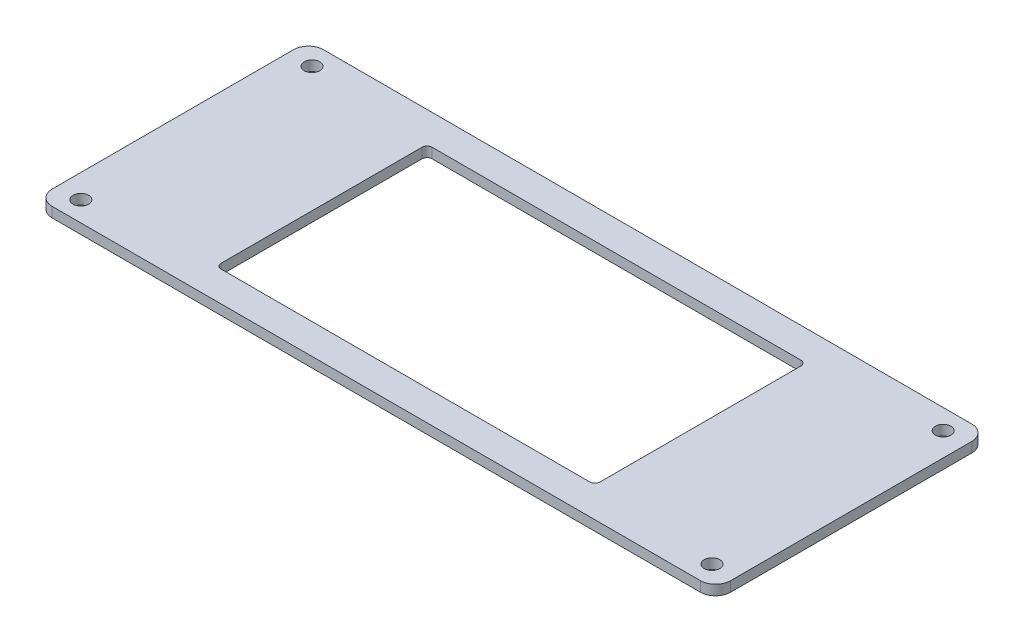
from build123d import *

# Parameters (mm, degrees)
EXTRUDE_1_DEPTH     = 2
SKETCH_3_W          = 10
SKETCH_3_H          = 54
EXTRUDE_2_DEPTH     = 2
SKETCH_2_R          = 1.55
CUT_EXTRUDE_1_DEPTH = 2
FILLET_1_R          = 3


with BuildPart() as part:
    # 草图1 → 凸台-拉伸1 (new body)
    with BuildSketch(Plane(origin=(0, 0, 0), x_dir=(1, 0, 0), z_dir=(0, 1, 0))):
        with BuildLine():
            Line((-59.5, -27), (-62.5, -27))
            Line((-62.5, -27), (-62.5, -24))
            Line((-62.5, -24), (-62.5, 24))
            Line((-62.5, 24), (-62.5, 27))
            Line((-62.5, 27), (-59.5, 27))
            Line((-59.5, 27), (59.5, 27))
            ThreePointArc((59.5, 27), (61.621320344, 26.121320344), (62.5, 24))
            Line((62.5, 24), (62.5, -24))
            ThreePointArc((62.5, -24), (61.621320344, -26.121320344), (59.5, -27))
            Line((59.5, -27), (-59.5, -27))
        make_face()
        with BuildLine():
            Line((-41.9, 21), (31.5, 21))
            ThreePointArc((31.5, 21), (32.207106781, 20.707106781), (32.5, 20))
            Line((32.5, 20), (32.5, -20))
            ThreePointArc((32.5, -20), (32.207106781, -20.707106781), (31.5, -21))
            Line((31.5, -21), (-41.9, -21))
            ThreePointArc((-41.9, -21), (-42.607106781, -20.707106781), (-42.9, -20))
            Line((-42.9, -20), (-42.9, 20))
            ThreePointArc((-42.9, 20), (-42.607106781, 20.707106781), (-41.9, 21))
        make_face(mode=Mode.SUBTRACT)
    extrude(amount=EXTRUDE_1_DEPTH)

    # 草图3 → 凸台-拉伸2 (add)
    with BuildSketch(Plane(origin=(0, 2, 0), x_dir=(1, 0, 0), z_dir=(0, 1, 0))):
        with Locations((-67.5, 0)):
            Rectangle(SKETCH_3_W, SKETCH_3_H)
    extrude(amount=-EXTRUDE_2_DEPTH)

    # 草图2 → 切除-拉伸1 (cut)
    with BuildSketch(Plane(origin=(0, 2, 0), x_dir=(1, 0, 0), z_dir=(0, 1, 0))):
        with Locations(Location((57.8, 23, 0), (0, 0, 270))):
            Circle(SKETCH_2_R)
        with Locations(Location((57.8, -23, 0), (0, 0, 90))):
            Circle(SKETCH_2_R)
        with Locations(Location((-67.8, -23, 0), (0, 0, 270))):
            Circle(SKETCH_2_R)
        with Locations(Location((-67.8, 23, 0), (0, 0, 90))):
            Circle(SKETCH_2_R)
    extrude(amount=-CUT_EXTRUDE_1_DEPTH, mode=Mode.SUBTRACT)

    # 圆角1
    fillet_1_edges = [part.edges().sort_by_distance(p)[0] for p in [
        (-72.5, 1, -27),
        (-72.5, 1, 27),
    ]]
    fillet(fillet_1_edges, radius=FILLET_1_R)


solid = part.part
